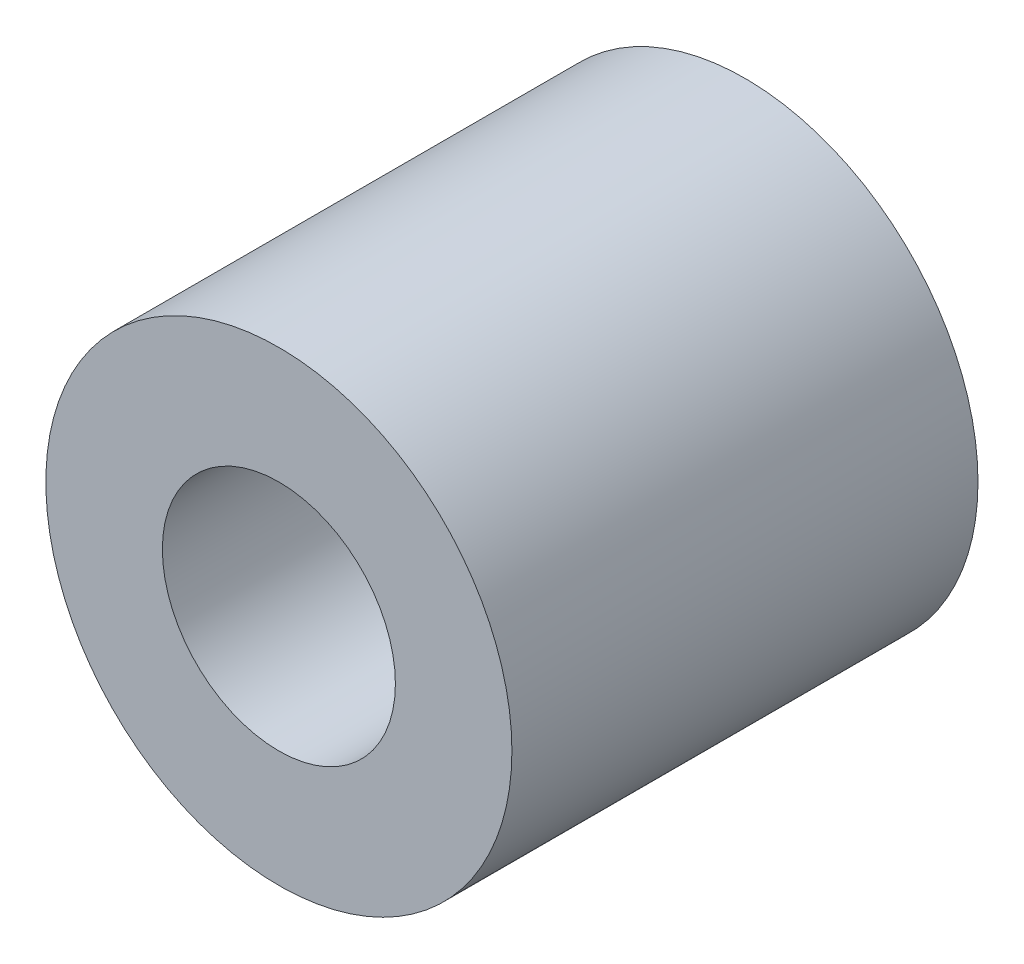
from build123d import *

# Parameters (mm, degrees)
SKETCH_1_R      = 3
SKETCH_1_R_2    = 1.5
EXTRUDE_1_DEPTH = 3


with BuildPart() as part:
    # 草图1 → 凸台-拉伸1 (new, symmetric)
    with BuildSketch(Plane.XY):
        Circle(SKETCH_1_R)
        Circle(SKETCH_1_R_2, mode=Mode.SUBTRACT)
    extrude(amount=EXTRUDE_1_DEPTH, both=True)


solid = part.part
